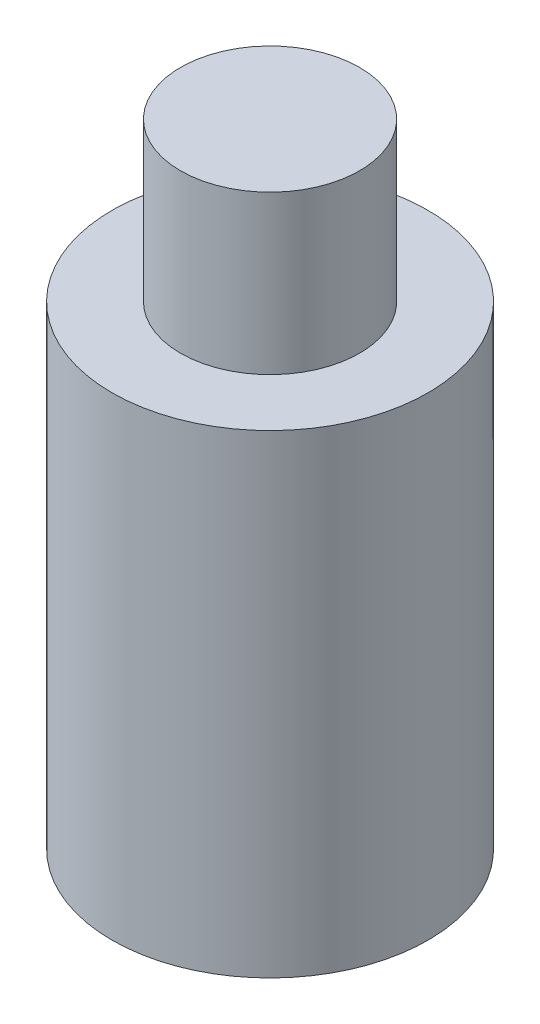
from build123d import *

# Parameters (mm, degrees)
SKETCH1_R           = 3
SKETCH1_R_2         = 1.7
BOSS_EXTRUDE1_DEPTH = 9
SKETCH2_R           = 1.7
BOSS_EXTRUDE2_DEPTH = 3


with BuildPart() as part:
    # Sketch1 → Boss-Extrude1 (new body)
    with BuildSketch(Plane(origin=(0, 3, 0), x_dir=(1, 0, 0), z_dir=(0, 1, 0))):
        with Locations(Location((21.5, 39, 0), (0, 0, 270))):
            Circle(SKETCH1_R)
        with Locations(Location((21.5, 39, 0), (0, 0, 270))):
            Circle(SKETCH1_R_2, mode=Mode.SUBTRACT)
    extrude(amount=BOSS_EXTRUDE1_DEPTH)


with BuildPart() as body_2:
    # Sketch2 → Boss-Extrude2 (new body)
    with BuildSketch(Plane(origin=(0, 12, 0), x_dir=(1, 0, 0), z_dir=(0, 1, 0))):
        with Locations(Location((21.5, 39, 0), (0, 0, 270))):
            Circle(SKETCH2_R)
    extrude(amount=BOSS_EXTRUDE2_DEPTH)


solid = Compound([part.part, body_2.part])
